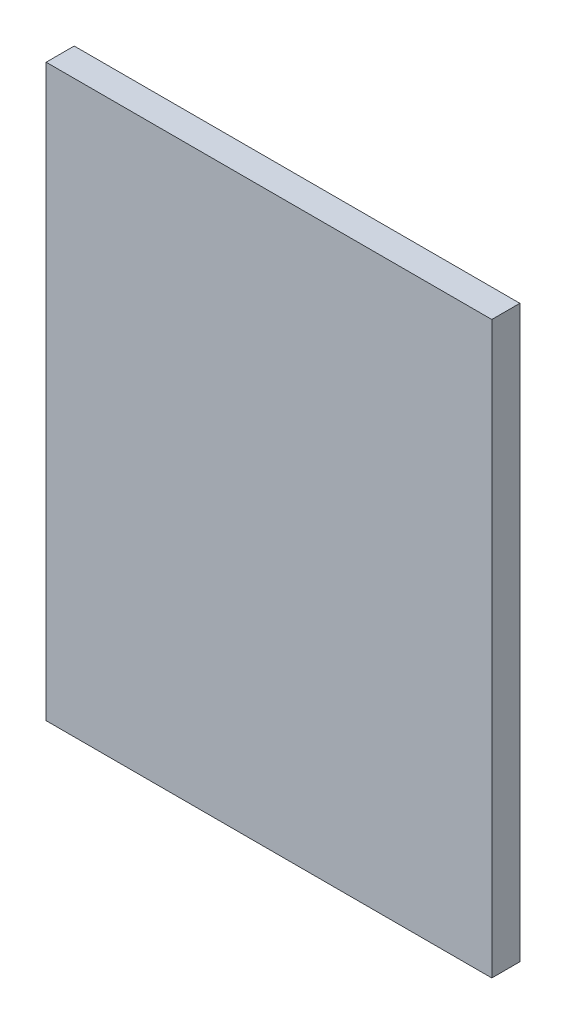
from build123d import *

# Parameters (mm, degrees)
SZKIC1_W                    = 286
SZKIC1_H                    = 366
DODANIE_WYCI_GNI_CIE1_DEPTH = 18


with BuildPart() as part:
    # Szkic1 → Dodanie-wyciągnięcie1 (new body)
    with BuildSketch(Plane.XY):
        Rectangle(SZKIC1_W, SZKIC1_H)
    extrude(amount=DODANIE_WYCI_GNI_CIE1_DEPTH)


solid = part.part
